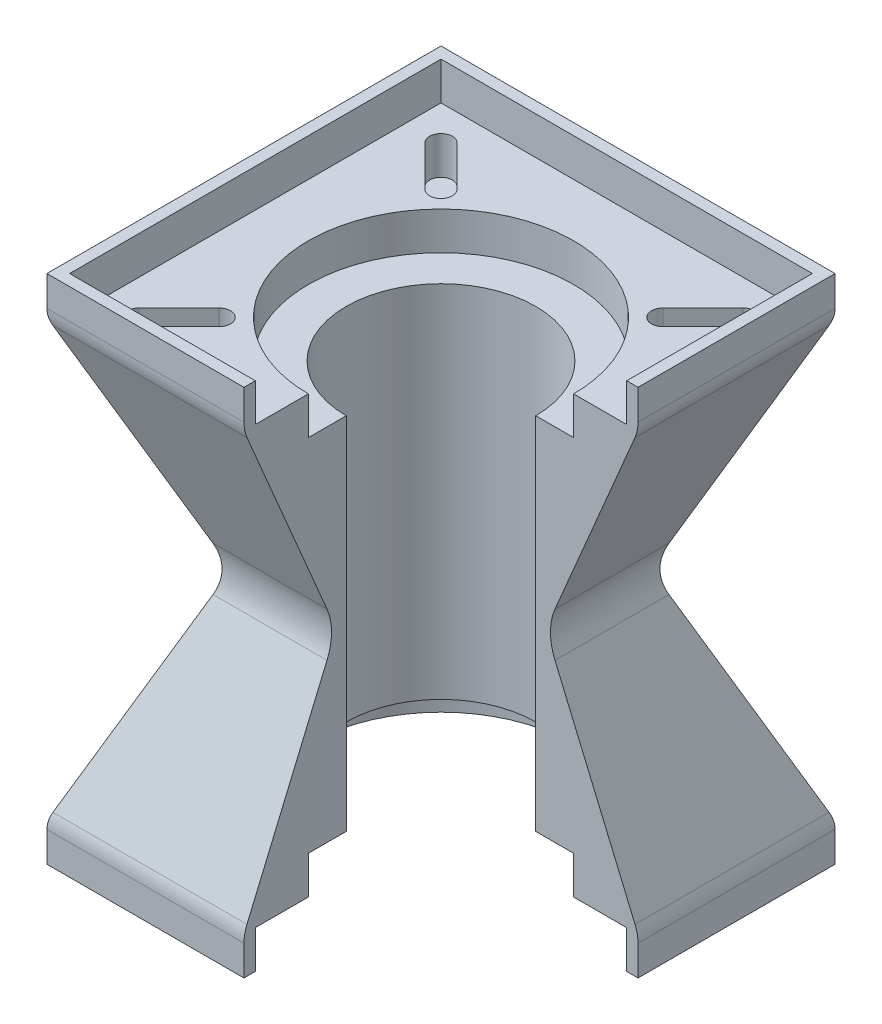
from build123d import *

# Parameters (mm, degrees)
SKETCH1_W           = 104
SKETCH1_H           = 104
BOSS_EXTRUDE1_DEPTH = 115
CUT_EXTRUDE1_DEPTH  = 187.70029459
SKETCH3_R           = 25
CUT_EXTRUDE2_DEPTH  = 187.70029459
CIRPATTERN1_COUNT   = 4
SKETCH4_R           = 35
CUT_EXTRUDE3_DEPTH  = 10
CUT_EXTRUDE4_START  = -10
SKETCH5_R           = 35
CUT_EXTRUDE4_DEPTH  = 10
FILLET2_R           = 15
SKETCH6_W           = 104
SKETCH6_H           = 104
SKETCH6_W_2         = 98
SKETCH6_H_2         = 98
BOSS_EXTRUDE2_DEPTH = 10
SKETCH7_W           = 104
SKETCH7_H           = 104
SKETCH7_W_2         = 98
SKETCH7_H_2         = 98
BOSS_EXTRUDE3_DEPTH = 10
CUT_EXTRUDE8_DEPTH  = 10
CUT_EXTRUDE9_DEPTH  = 10
FILLET3_R           = 10
SKETCH11_W          = 52
SKETCH11_H          = 52
CUT_EXTRUDE11_DEPTH = 200.642179912


with BuildPart() as part:
    # Sketch1 → Boss-Extrude1 (new body)
    with BuildSketch(Plane(origin=(0, 0, 0), x_dir=(1, 0, 0), z_dir=(0, 1, 0))):
        with Locations((52, 52)):
            Rectangle(SKETCH1_W, SKETCH1_H)
    extrude(amount=BOSS_EXTRUDE1_DEPTH)

    # Sketch2 → Cut-Extrude1 (cut, symmetric)
    with BuildSketch(Plane.XY):
        Polygon((229.074287939, 409.656557146), (104, 115), (79.592698068, 57.5), (104, 0), (229.074287939, -294.656557146), (869.280705191, -294.656557146), (869.280705191, 409.656557146), align=None)
    cut_extrude1 = extrude(amount=CUT_EXTRUDE1_DEPTH, both=True, mode=Mode.SUBTRACT)

    # Sketch3 → Cut-Extrude2 (cut, through all)
    with BuildSketch(Plane(origin=(0, 115, 0), x_dir=(1, 0, 0), z_dir=(0, 1, 0))):
        with Locations(Location((52, 52, 0), (0, 0, 270))):
            Circle(SKETCH3_R)
    cut_extrude2 = extrude(amount=-CUT_EXTRUDE2_DEPTH, mode=Mode.SUBTRACT)

    # CirPattern1: Cut-Extrude1, Cut-Extrude2 ×4 about axis
    cirpattern1_axis = Axis((52, 0, -52), (0, 1, 0))
    add([cut_extrude1.rotate(cirpattern1_axis, i * 360 / CIRPATTERN1_COUNT) for i in range(1, CIRPATTERN1_COUNT)], mode=Mode.SUBTRACT)
    add([cut_extrude2.rotate(cirpattern1_axis, i * 360 / CIRPATTERN1_COUNT) for i in range(1, CIRPATTERN1_COUNT)], mode=Mode.SUBTRACT)

    # Sketch4 → Cut-Extrude3 (cut)
    with BuildSketch(Plane(origin=(0, 115, 0), x_dir=(1, 0, 0), z_dir=(0, 1, 0))):
        with Locations(Location((52, 52, 0), (0, 0, 270))):
            Circle(SKETCH4_R)
    extrude(amount=-CUT_EXTRUDE3_DEPTH, mode=Mode.SUBTRACT)

    # Sketch5 → Cut-Extrude4 (cut)
    with BuildSketch(Plane.XZ.offset(CUT_EXTRUDE4_START)):
        with Locations(Location((52, -52, 0), (0, 0, 90))):
            Circle(SKETCH5_R)
    extrude(amount=CUT_EXTRUDE4_DEPTH, mode=Mode.SUBTRACT)

    # Fillet2
    fillet2_edges = [part.edges().sort_by_distance(p)[0] for p in [
        (79.592698068, 57.5, -52),
        (52, 57.5, -24.407301932),
        (24.407301932, 57.5, -52),
        (52, 57.5, -79.592698068),
    ]]
    fillet(fillet2_edges, radius=FILLET2_R)

    # Sketch6 → Boss-Extrude2 (add)
    with BuildSketch(Plane(origin=(0, 115, 0), x_dir=(1, 0, 0), z_dir=(0, 1, 0))):
        with Locations((52, 52)):
            Rectangle(SKETCH6_W, SKETCH6_H)
        with Locations((52, 52)):
            Rectangle(SKETCH6_W_2, SKETCH6_H_2, mode=Mode.SUBTRACT)
    extrude(amount=BOSS_EXTRUDE2_DEPTH)

    # Sketch7 → Boss-Extrude3 (add)
    with BuildSketch(Plane.XZ):
        with Locations((52, -52)):
            Rectangle(SKETCH7_W, SKETCH7_H)
        with Locations((52, -52)):
            Rectangle(SKETCH7_W_2, SKETCH7_H_2, mode=Mode.SUBTRACT)
    extrude(amount=BOSS_EXTRUDE3_DEPTH)

    # Sketch8 → Cut-Extrude8 (cut)
    with BuildSketch(Plane.XZ):
        with BuildLine():
            Line((85.587572106, -22.655068581), (96.194173824, -12.048466863))
            ThreePointArc((96.194173824, -12.048466863), (96.194173824, -7.805826176), (91.951533137, -7.805826176))
            Line((91.951533137, -7.805826176), (81.344931419, -18.412427894))
            ThreePointArc((81.344931419, -18.412427894), (81.344931419, -22.655068581), (85.587572106, -22.655068581))
        make_face()
        with BuildLine():
            Line((18.412427894, -81.344931419), (7.805826176, -91.951533137))
            ThreePointArc((7.805826176, -91.951533137), (7.805826176, -96.194173824), (12.048466863, -96.194173824))
            Line((12.048466863, -96.194173824), (22.655068581, -85.587572106))
            ThreePointArc((22.655068581, -85.587572106), (22.655068581, -81.344931419), (18.412427894, -81.344931419))
        make_face()
        with BuildLine():
            Line((22.655068581, -18.412427894), (12.048466863, -7.805826176))
            ThreePointArc((12.048466863, -7.805826176), (7.805826176, -7.805826176), (7.805826176, -12.048466863))
            Line((7.805826176, -12.048466863), (18.412427894, -22.655068581))
            ThreePointArc((18.412427894, -22.655068581), (22.655068581, -22.655068581), (22.655068581, -18.412427894))
        make_face()
        with BuildLine():
            Line((81.344931419, -85.587572106), (91.951533137, -96.194173824))
            ThreePointArc((91.951533137, -96.194173824), (96.194173824, -96.194173824), (96.194173824, -91.951533137))
            Line((96.194173824, -91.951533137), (85.587572106, -81.344931419))
            ThreePointArc((85.587572106, -81.344931419), (81.344931419, -81.344931419), (81.344931419, -85.587572106))
        make_face()
    extrude(amount=-CUT_EXTRUDE8_DEPTH, mode=Mode.SUBTRACT)

    # Sketch9 → Cut-Extrude9 (cut)
    with BuildSketch(Plane(origin=(0, 115, 0), x_dir=(1, 0, 0), z_dir=(0, 1, 0))):
        with BuildLine():
            Line((79.141990106, 83.384630793), (89.748591824, 93.991232511))
            ThreePointArc((89.748591824, 93.991232511), (93.991232511, 93.991232511), (93.991232511, 89.748591824))
            Line((93.991232511, 89.748591824), (83.384630793, 79.141990106))
            ThreePointArc((83.384630793, 79.141990106), (79.141990106, 79.141990106), (79.141990106, 83.384630793))
        make_face()
        with BuildLine():
            Line((83.384630793, 24.858009894), (93.991232511, 14.251408176))
            ThreePointArc((93.991232511, 14.251408176), (93.991232511, 10.008767489), (89.748591824, 10.008767489))
            Line((89.748591824, 10.008767489), (79.141990106, 20.615369207))
            ThreePointArc((79.141990106, 20.615369207), (79.141990106, 24.858009894), (83.384630793, 24.858009894))
        make_face()
        with BuildLine():
            Line((24.858009894, 20.615369207), (14.251408176, 10.008767489))
            ThreePointArc((14.251408176, 10.008767489), (10.008767489, 10.008767489), (10.008767489, 14.251408176))
            Line((10.008767489, 14.251408176), (20.615369207, 24.858009894))
            ThreePointArc((20.615369207, 24.858009894), (24.858009894, 24.858009894), (24.858009894, 20.615369207))
        make_face()
        with BuildLine():
            Line((20.615369207, 79.141990106), (10.008767489, 89.748591824))
            ThreePointArc((10.008767489, 89.748591824), (10.008767489, 93.991232511), (14.251408176, 93.991232511))
            Line((14.251408176, 93.991232511), (24.858009894, 83.384630793))
            ThreePointArc((24.858009894, 83.384630793), (24.858009894, 79.141990106), (20.615369207, 79.141990106))
        make_face()
    extrude(amount=-CUT_EXTRUDE9_DEPTH, mode=Mode.SUBTRACT)

    # Fillet3
    fillet3_edges = [part.edges().sort_by_distance(p)[0] for p in [
        (104, 115, -52),
        (52, 115, -104),
        (0, 115, -52),
        (52, 0, -104),
        (104, 0, -52),
        (52, 0, 0),
        (0, 0, -52),
        (52, 115, 0),
    ]]
    fillet(fillet3_edges, radius=FILLET3_R)

    # Sketch11 → Cut-Extrude11 (cut, through all)
    with BuildSketch(Plane(origin=(0, 125, 0), x_dir=(1, 0, 0), z_dir=(0, 1, 0))):
        with Locations((78, 26)):
            Rectangle(SKETCH11_W, SKETCH11_H)
    extrude(amount=-CUT_EXTRUDE11_DEPTH, mode=Mode.SUBTRACT)


solid = part.part
